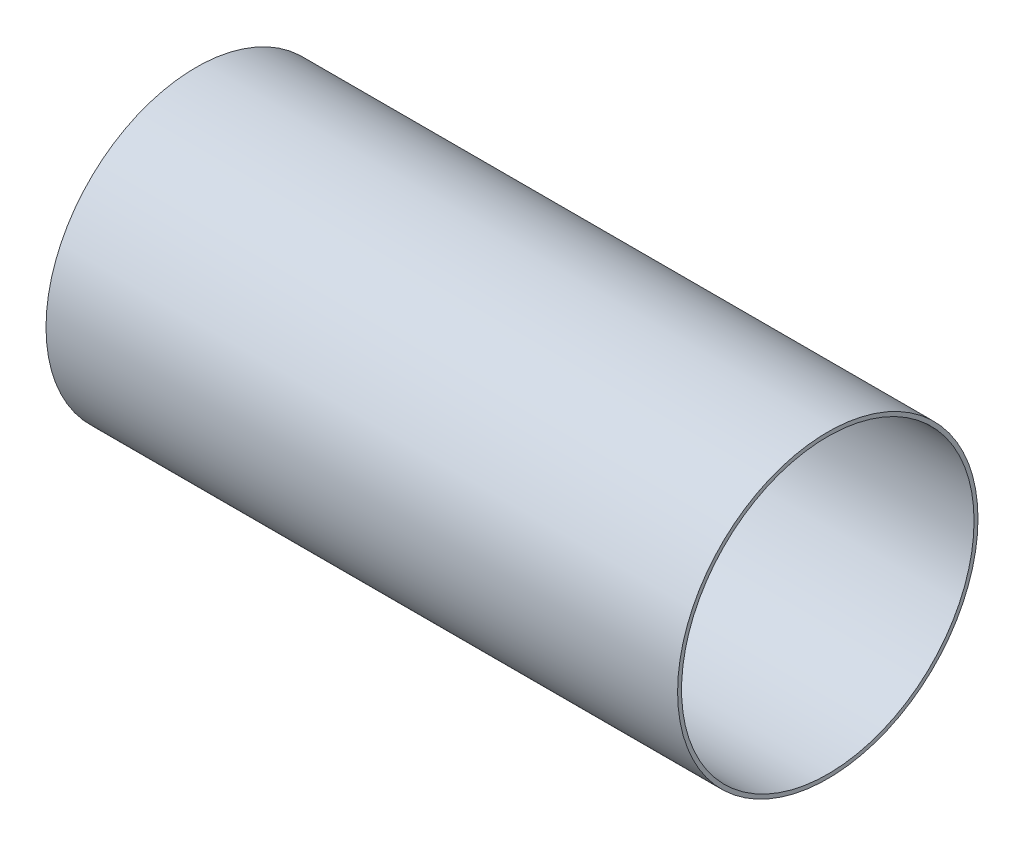
from build123d import *

# Parameters (mm, degrees)
SKETCH1_R           = 76.1
SKETCH1_R_2         = 74.1
BOSS_EXTRUDE1_DEPTH = 320


with BuildPart() as part:
    # Sketch1 → Boss-Extrude1 (new body)
    with BuildSketch(Plane(origin=(0, 0, 0), x_dir=(0, 0, -1), z_dir=(1, 0, 0))):
        Circle(SKETCH1_R)
        Circle(SKETCH1_R_2, mode=Mode.SUBTRACT)
    extrude(amount=BOSS_EXTRUDE1_DEPTH)


solid = part.part
